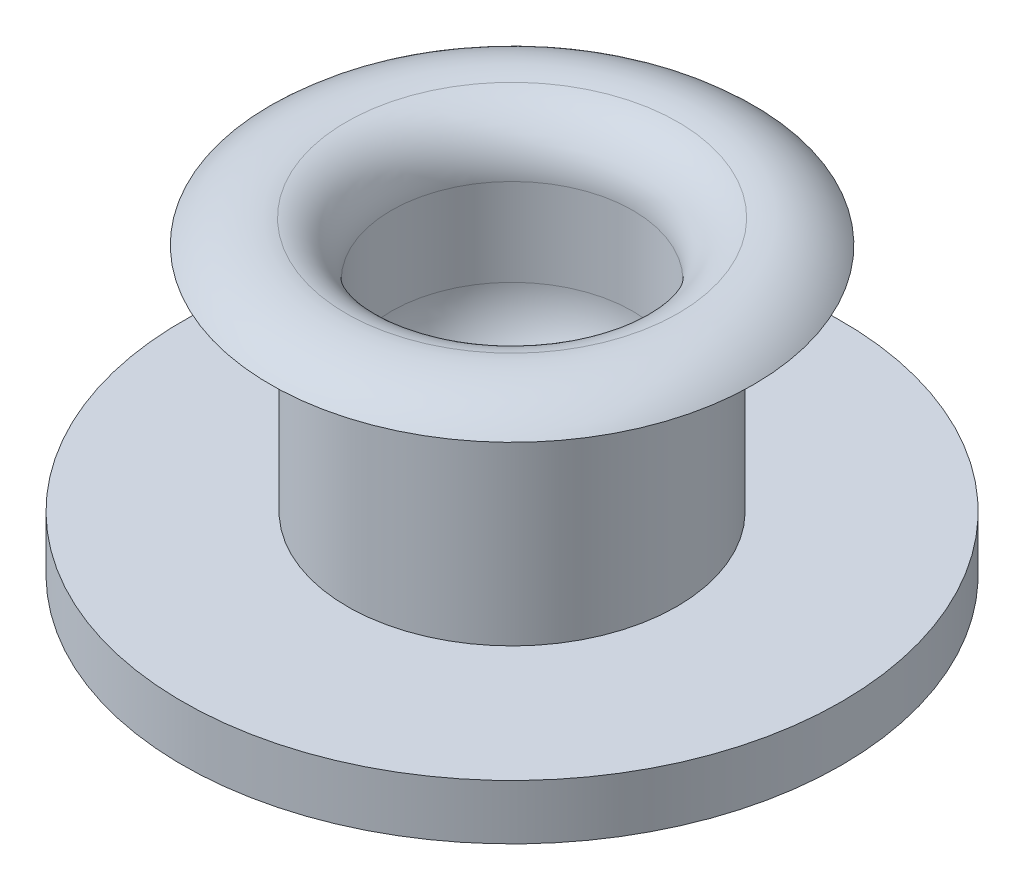
from build123d import *

# Parameters (mm, degrees)
FILLET1_R           = 0.8
FILLET2_R           = 0.5
SKETCH2_R           = 3
BOSS_EXTRUDE1_DEPTH = 0.5


with BuildPart() as part:
    # Sketch1 → Revolve1 (revolve)
    with BuildSketch(Plane.XY, mode=Mode.PRIVATE) as revolve1_sk:
        with BuildLine():
            Line((-1.5, 1), (-2.2, 1))
            ThreePointArc((-2.2, 1), (-1.65, 1.227674865), (-1.1, 1))
            Line((-1.1, 1), (-1.1, -0.762073649))
            Line((-1.1, -0.762073649), (0, -0.924951874))
            Line((0, -0.924951874), (0, -1.1))
            Line((0, -1.1), (-1.5, -1.1))
            Line((-1.5, -1.1), (-1.5, 1))
        make_face()
    revolve(revolve1_sk.sketch.rotate(Axis((0, -1.1, 0), (0, 1, 0)), 180), axis=Axis((0, -1.1, 0), (0, 1, 0)))

    # Fillet1
    fillet1_edges = [part.edges().sort_by_distance(p)[0] for p in [
        (-1.1, -0.762073649, 0),
    ]]
    fillet(fillet1_edges, radius=FILLET1_R)

    # Fillet2
    fillet2_edges = [part.edges().sort_by_distance(p)[0] for p in [
        (-1.1, 1, 0),
    ]]
    fillet(fillet2_edges, radius=FILLET2_R)

    # Sketch2 → Boss-Extrude1 (add)
    with BuildSketch(Plane.XZ.offset(1.1)):
        Circle(SKETCH2_R)
    extrude(amount=BOSS_EXTRUDE1_DEPTH)


solid = part.part
